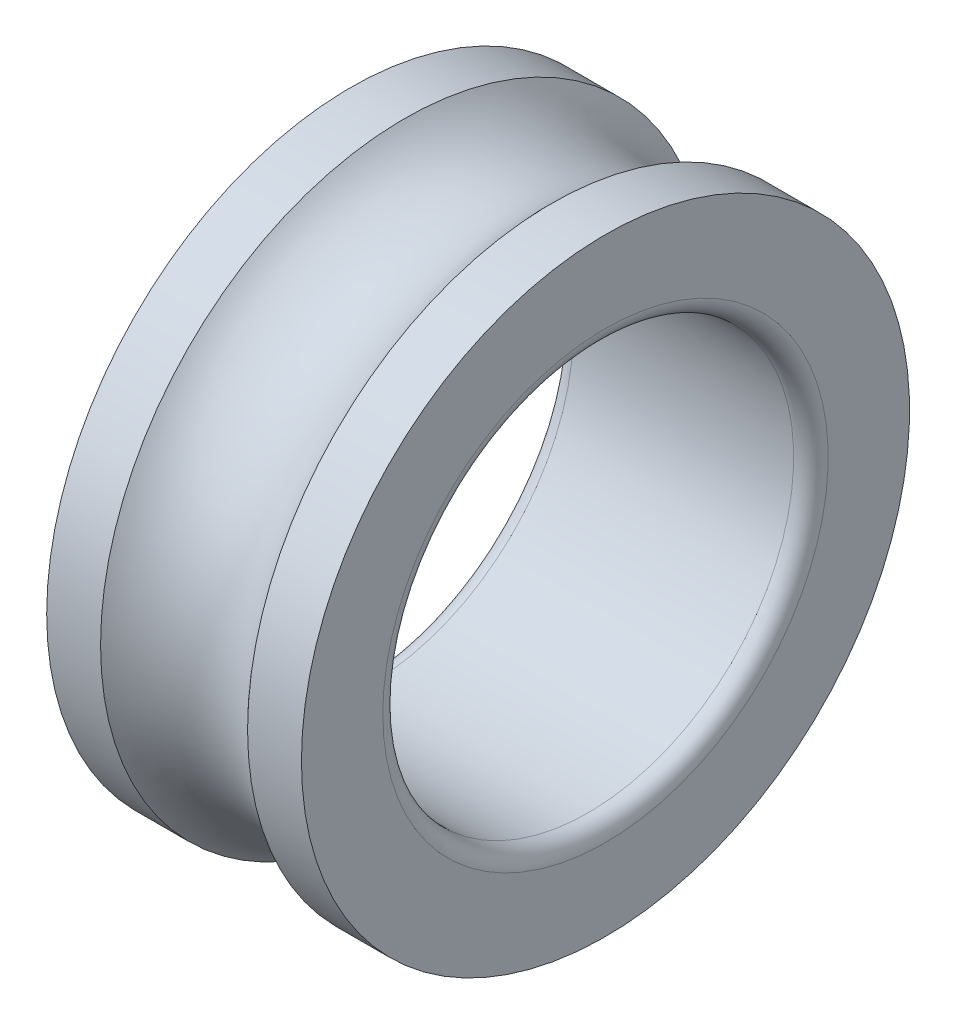
from build123d import *


with BuildPart() as part:
    # Sketch1 → Revolve1 (revolve)
    with BuildSketch(Plane.XY, mode=Mode.PRIVATE) as revolve1_sk:
        with BuildLine():
            Line((4.472135955, 18.5), (7.75, 18.5))
            Line((7.75, 18.5), (7.75, 13.55))
            ThreePointArc((7.75, 13.55), (7.44246212, 12.80753788), (6.7, 12.5))
            Line((6.7, 12.5), (-6.7, 12.5))
            ThreePointArc((-6.7, 12.5), (-7.44246212, 12.80753788), (-7.75, 13.55))
            Line((-7.75, 13.55), (-7.75, 18.5))
            Line((-7.75, 18.5), (-4.472135955, 18.5))
            ThreePointArc((-4.472135955, 18.5), (0, 16.5), (4.472135955, 18.5))
        make_face()
    revolve(revolve1_sk.sketch.rotate(Axis((0, 0, 0), (1, 0, 0)), 90), axis=Axis((0, 0, 0), (1, 0, 0)))


solid = part.part
